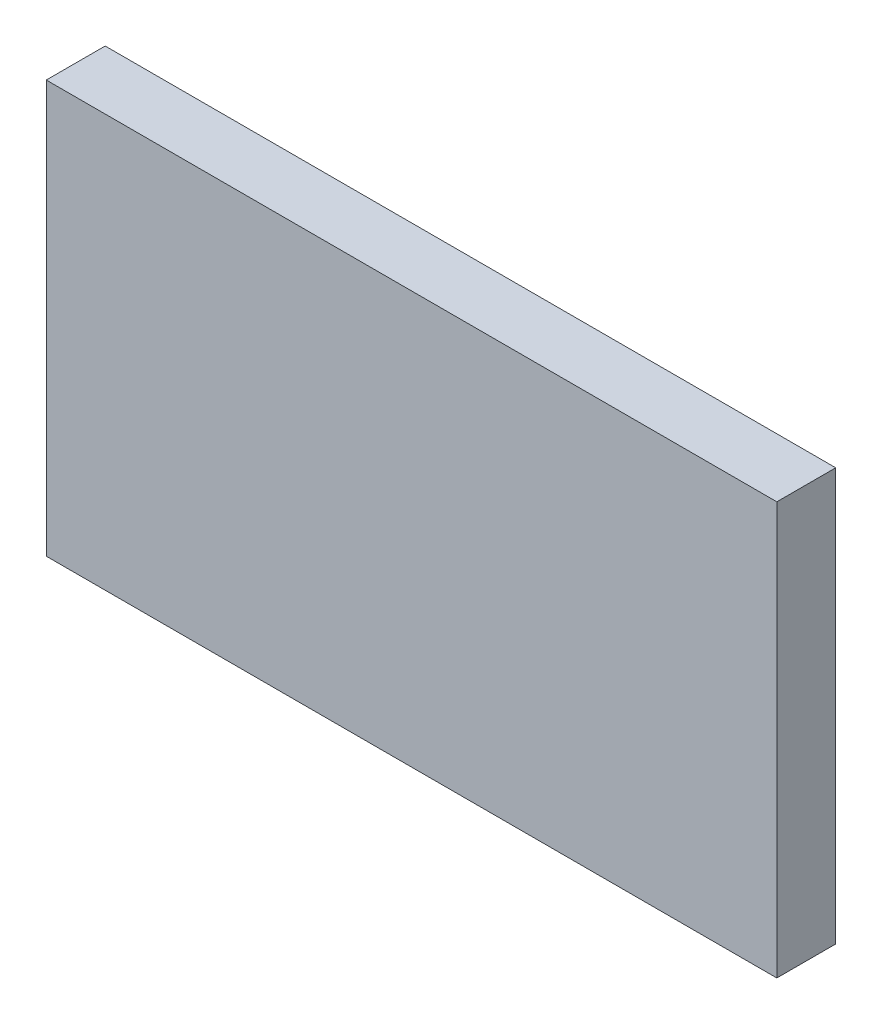
from build123d import *

# Parameters (mm, degrees)
ESQUISSE1_W        = 124
ESQUISSE1_H        = 70
BOSS_EXTRU_1_DEPTH = 10


with BuildPart() as part:
    # Esquisse1 → Boss.-Extru.1 (new body)
    with BuildSketch(Plane.XY):
        with Locations((62, 35)):
            Rectangle(ESQUISSE1_W, ESQUISSE1_H)
    extrude(amount=BOSS_EXTRU_1_DEPTH)


solid = part.part
